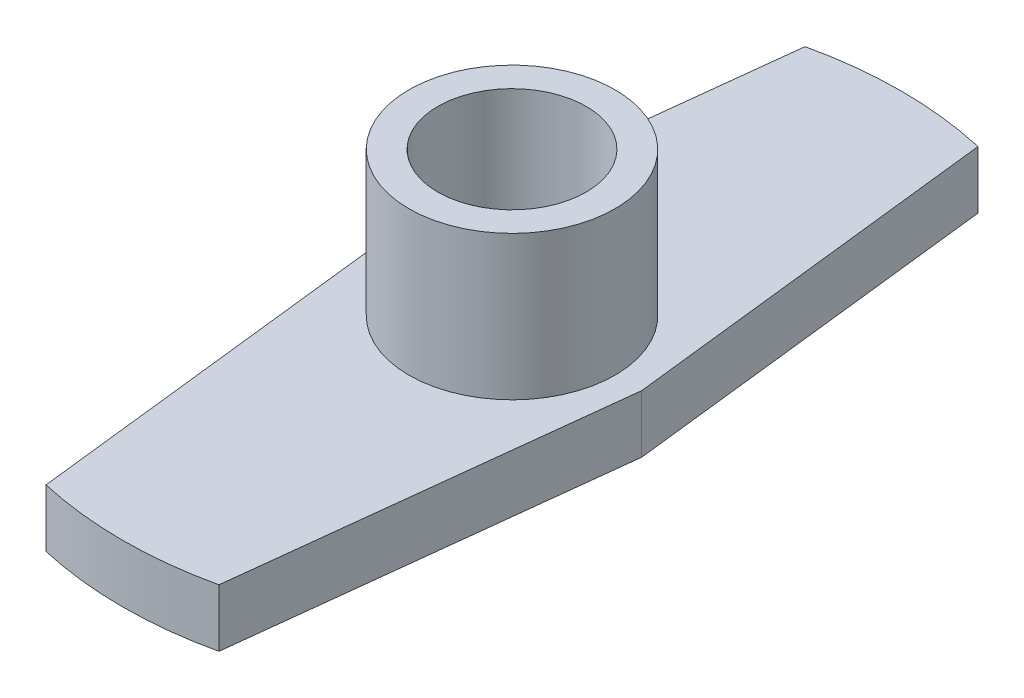
from build123d import *

# Parameters (mm, degrees)
SALIENTE_EXTRUIR1_DEPTH = 2
CROQUIS3_R              = 3.575
CROQUIS3_R_2            = 2.575
SALIENTE_EXTRUIR2_DEPTH = 5


with BuildPart() as part:
    # Croquis1 → Saliente-Extruir1 (new body)
    with BuildSketch(Plane(origin=(0, 0, 0), x_dir=(1, 0, 0), z_dir=(0, 1, 0))):
        with BuildLine():
            Line((-3, 13.162446581), (-4.5, 0))
            Line((-4.5, 0), (-3, -13.162446581))
            ThreePointArc((-3, -13.162446581), (0, -13.5), (3, -13.162446581))
            Line((3, -13.162446581), (4.5, 0))
            Line((4.5, 0), (3, 13.162446581))
            ThreePointArc((3, 13.162446581), (0, 13.5), (-3, 13.162446581))
        make_face()
    extrude(amount=SALIENTE_EXTRUIR1_DEPTH)

    # Croquis3 → Saliente-Extruir2 (add)
    with BuildSketch(Plane(origin=(0, 2, 0), x_dir=(1, 0, 0), z_dir=(0, 1, 0))):
        with Locations(Location((0, 0, 0), (0, 0, 270))):
            Circle(CROQUIS3_R)
        with Locations(Location((0, 0, 0), (0, 0, 270))):
            Circle(CROQUIS3_R_2, mode=Mode.SUBTRACT)
    extrude(amount=SALIENTE_EXTRUIR2_DEPTH)


solid = part.part
